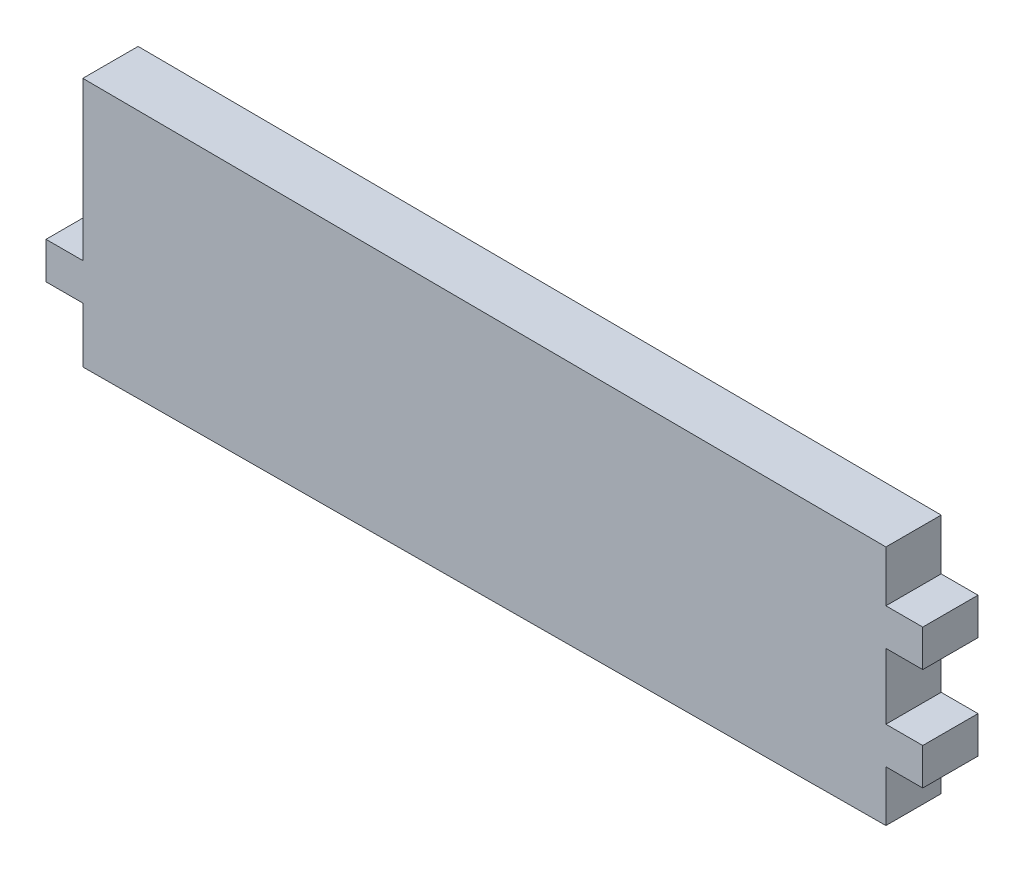
from build123d import *

# Parameters (mm, degrees)
BOSS_EXTRUDE1_DEPTH = 4.7625


with BuildPart() as part:
    # Sketch1 → Boss-Extrude1 (new body)
    with BuildSketch(Plane.XY):
        Polygon((129.113772097, -23.286367498), (132.288772097, -23.286367498), (132.288772097, -9.681374977), (201.503772097, -10.055191911), (201.503772097, -14.447167498), (204.678772097, -14.447167498), (204.678772097, -17.622167498), (201.503772097, -17.622167498), (201.503772097, -23.286367498), (204.678772097, -23.286367498), (204.678772097, -26.461367498), (201.503772097, -26.461367498), (201.503772097, -30.853451146), (132.288772097, -31.227230038), (132.288772097, -26.461367498), (129.113772097, -26.461367498), align=None)
    extrude(amount=BOSS_EXTRUDE1_DEPTH)


solid = part.part
